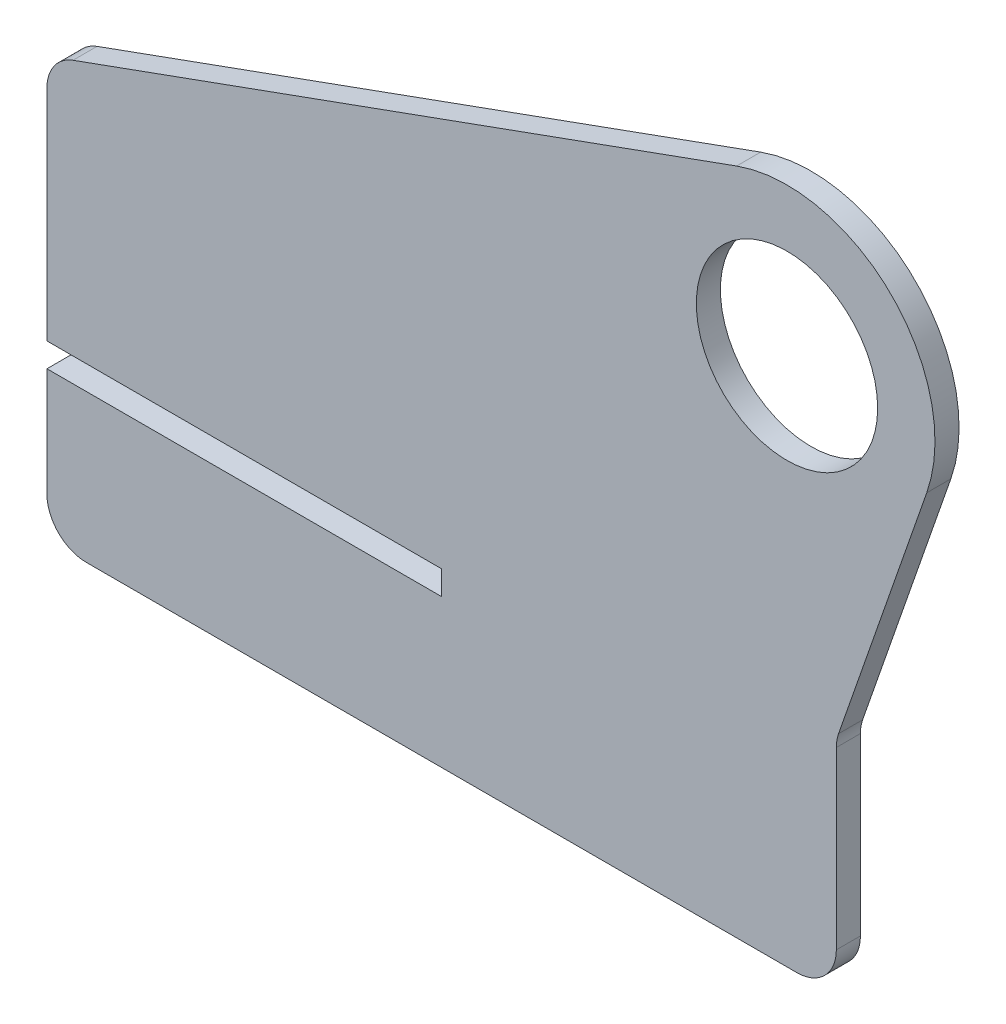
from build123d import *

# Parameters (mm, degrees)
BOSS_EXTRUDE1_DEPTH = 3.0988
SKETCH3_R           = 1.0795
SKETCH3_R_2         = 11.6713
BOSS_EXTRUDE2_DEPTH = 3.0988
SKETCH4_R           = 1.0795
CUT_EXTRUDE1_DEPTH  = 122.505558808
FILLET1_R           = 5.08


with BuildPart() as part:
    # Sketch2 → Boss-Extrude1 (new body)
    with BuildSketch(Plane.XY):
        Polygon((-50.8, 1.5494), (-50.8, 7.8994), (50.8, 7.8994), (50.8, -7.8994), (-50.8, -7.8994), (-50.8, -1.5494), (0, -1.5494), (0, 1.5494), align=None)
    extrude(amount=BOSS_EXTRUDE1_DEPTH)

    # Sketch3 → Boss-Extrude2 (add)
    with BuildSketch(Plane.XY):
        with BuildLine():
            Line((50.8, -7.8994), (-50.8, -7.8994))
            Line((-50.8, -7.8994), (-50.8, -20.5994))
            Line((-50.8, -20.5994), (101.6, -20.5994))
            Line((101.6, -20.5994), (101.6, 33.2994))
            Line((101.6, 33.2994), (54.782161872, 63.523702231))
            ThreePointArc((54.782161872, 63.523702231), (46.597523005, 66.447615713), (37.96588061, 65.431577828))
            Line((37.96588061, 65.431577828), (-50.8, 33.2994))
            Line((-50.8, 33.2994), (-50.8, 7.8994))
            Line((-50.8, 7.8994), (50.8, 7.8994))
            Line((50.8, 7.8994), (50.8, -7.8994))
        make_face()
        with Locations((76.2, 0)):
            Circle(SKETCH3_R, mode=Mode.SUBTRACT)
        with Locations((44.45, 47.519048812)):
            Circle(SKETCH3_R_2, mode=Mode.SUBTRACT)
    extrude(amount=BOSS_EXTRUDE2_DEPTH)

    # Sketch4 → Cut-Extrude1 (cut, through all)
    with BuildSketch(Plane.XY.offset(3.0988)):
        with BuildLine():
            ThreePointArc((63.5, 47.519048812), (63.232160807, 44.33582161), (62.436174759, 41.242105484))
            Line((62.436174759, 41.242105484), (50.8, 7.8994))
            Line((50.8, 7.8994), (50.8, -20.5994))
            Line((50.8, -20.5994), (101.6, -20.5994))
            Line((101.6, -20.5994), (101.6, 33.2994))
            Line((101.6, 33.2994), (54.782161872, 63.523702231))
            ThreePointArc((54.782161872, 63.523702231), (61.179168892, 56.6315352), (63.5, 47.519048812))
        make_face()
        with Locations((76.2, 0)):
            Circle(SKETCH4_R, mode=Mode.SUBTRACT)
    extrude(amount=-CUT_EXTRUDE1_DEPTH, mode=Mode.SUBTRACT)

    # Fillet1
    fillet1_edges = [part.edges().sort_by_distance(p)[0] for p in [
        (-50.8, -20.5994, 1.5494),
        (-50.8, 33.2994, 1.5494),
        (50.8, 7.8994, 1.5494),
        (50.8, -20.5994, 1.5494),
    ]]
    fillet(fillet1_edges, radius=FILLET1_R)


solid = part.part
